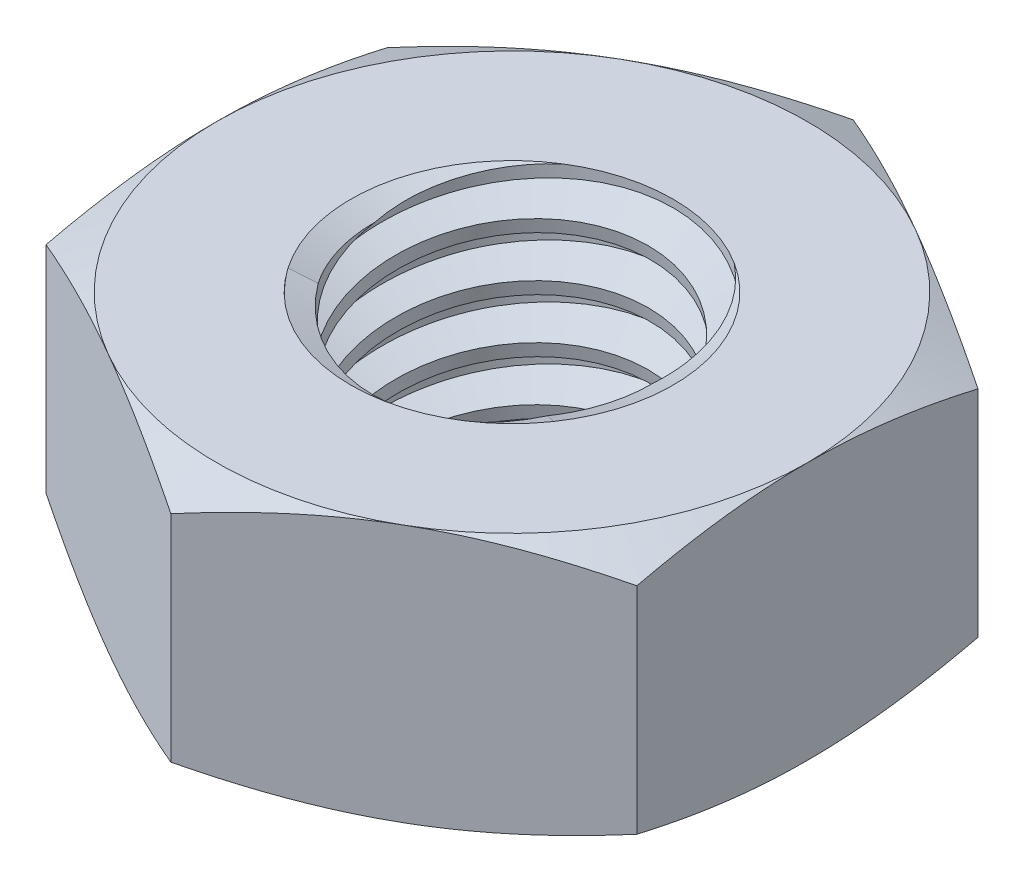
from build123d import *

# Parameters (mm, degrees)
EXTRUDE1_DEPTH       = 1.2
SKETCH2_W            = 1.5
SKETCH2_H            = 2.4
LPATTERN1_COUNT      = 5
LPATTERN1_PITCH      = 0.5
LPATTERN1_COUNT_DIR2 = 2
LPATTERN1_PITCH_DIR2 = 0.5


with BuildPart() as part:
    # Sketch1 → Extrude1 (new, symmetric)
    with BuildSketch(Plane(origin=(0, 0, 0), x_dir=(1, 0, 0), z_dir=(0, 1, 0))):
        Polygon((0, 3.175426481), (-2.75, 1.58771324), (-2.75, -1.58771324), (0, -3.175426481), (2.75, -1.58771324), (2.75, 1.58771324), align=None)
    extrude(amount=EXTRUDE1_DEPTH, both=True)

    # Sketch4 → Cut-Revolve2 (revolve, cut)
    with BuildSketch(Plane(origin=(0, 0, 0), x_dir=(0, 0, -1), z_dir=(1, 0, 0))):
        Polygon((0, 1.2), (1.5, 1.2), (1.269011592, 1.092288336), (1.269011592, -1.092288336), (1.5, -1.2), (0, -1.2), align=None)
    revolve(axis=Axis((0, 1.2, 0), (0, 1, 0)), mode=Mode.SUBTRACT)


with BuildPart() as body_2:
    # Sketch2 → Revolve1 (revolve)
    with BuildSketch(Plane(origin=(0, 0, 0), x_dir=(0, 0, -1), z_dir=(1, 0, 0))):
        with Locations((0.75, 0)):
            Rectangle(SKETCH2_W, SKETCH2_H)
    revolve(axis=Axis((0, -2.7, 0), (0, 1, 0)))

    # Sketch3 → Cut-Revolve1 (revolve, cut)
    with BuildSketch(Plane(origin=(0, 0, 0), x_dir=(0, 0, -1), z_dir=(1, 0, 0))):
        Polygon((1.510274937, 1.13835038), (1.582199494, 0.706803038), (1.289561466, 0.816435308), (1.269011592, 0.939734548), align=None)
    cut_revolve1 = revolve(axis=Axis((0, 1.2, 0.089188249), (0, -0.9863939238321437, -0.16439898730535749)), mode=Mode.SUBTRACT)

    # LPattern1: Cut-Revolve1 5 × 2
    with Locations(*[Vector(0, -1, 0) * (i * LPATTERN1_PITCH) + Vector(0, 1, 0) * (j * LPATTERN1_PITCH_DIR2) for i in range(LPATTERN1_COUNT) for j in range(LPATTERN1_COUNT_DIR2) if (i, j) != (0, 0)]):
        add(cut_revolve1, mode=Mode.SUBTRACT)


with BuildPart() as part_1:
    add(part.part)

    # Combine1: cut body 2
    add(body_2.part, mode=Mode.SUBTRACT)

    # Sketch5 → Cut-Revolve3 (revolve, cut)
    with BuildSketch(Plane(origin=(0, 0, 0), x_dir=(0, 0, -1), z_dir=(1, 0, 0))):
        Polygon((0, -1.2), (2.75, -1.2), (3.175426481, -1.001620374), (3.175426481, 1.001620374), (2.75, 1.2), (0, 1.2), (0, 2.47), (4.445426481, 2.47), (4.445426481, -2.47), (0, -2.47), align=None)
    revolve(axis=Axis((0, -1.2, 0), (0, 1, 0)), mode=Mode.SUBTRACT)


solid = part_1.part
